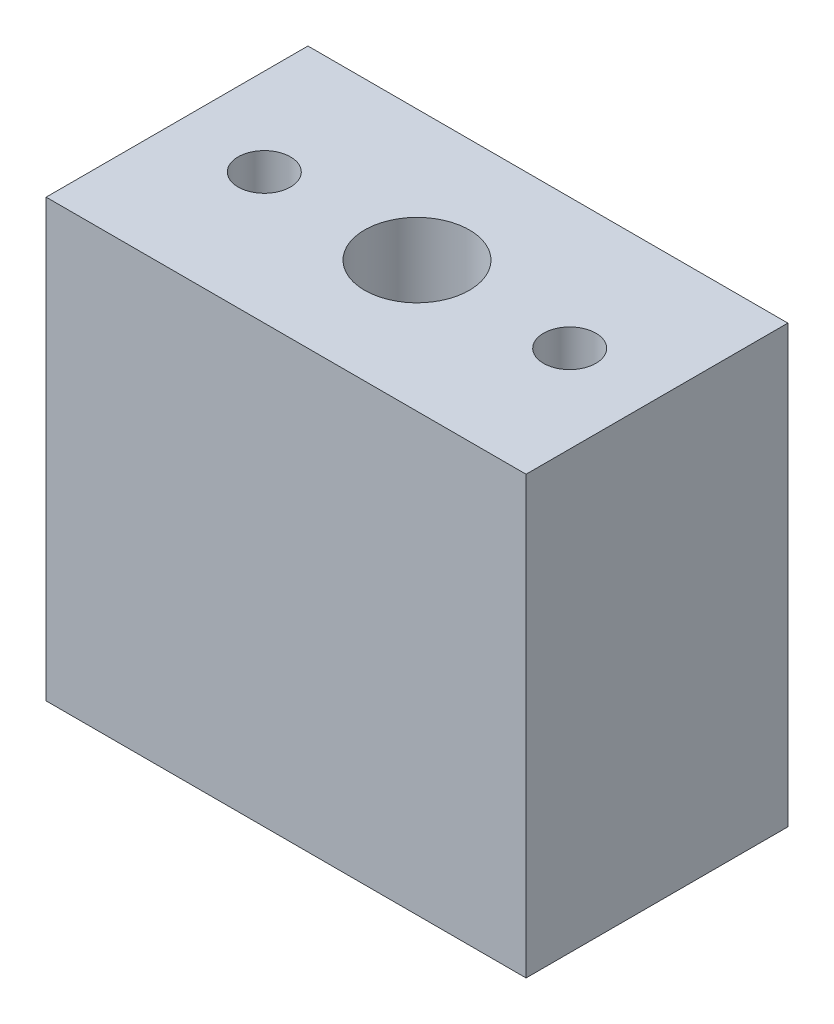
from build123d import *

# Parameters (mm, degrees)
SKETCH1_W           = 5.5
SKETCH1_H           = 3
SKETCH1_R           = 0.6
SKETCH1_R_2         = 0.3
BOSS_EXTRUDE1_DEPTH = 5


with BuildPart() as part:
    # Sketch1 → Boss-Extrude1 (new body)
    with BuildSketch(Plane(origin=(0, 0, 0), x_dir=(1, 0, 0), z_dir=(0, 1, 0))):
        with Locations((-1.25, 0)):
            Rectangle(SKETCH1_W, SKETCH1_H)
        with Locations(Location((-1.25, 0, 0), (0, 0, 270))):
            Circle(SKETCH1_R, mode=Mode.SUBTRACT)
        with Locations(Location((-3, 0, 0), (0, 0, 270))):
            Circle(SKETCH1_R_2, mode=Mode.SUBTRACT)
        with Locations(Location((0.5, 0, 0), (0, 0, 270))):
            Circle(SKETCH1_R_2, mode=Mode.SUBTRACT)
    extrude(amount=BOSS_EXTRUDE1_DEPTH)


solid = part.part
